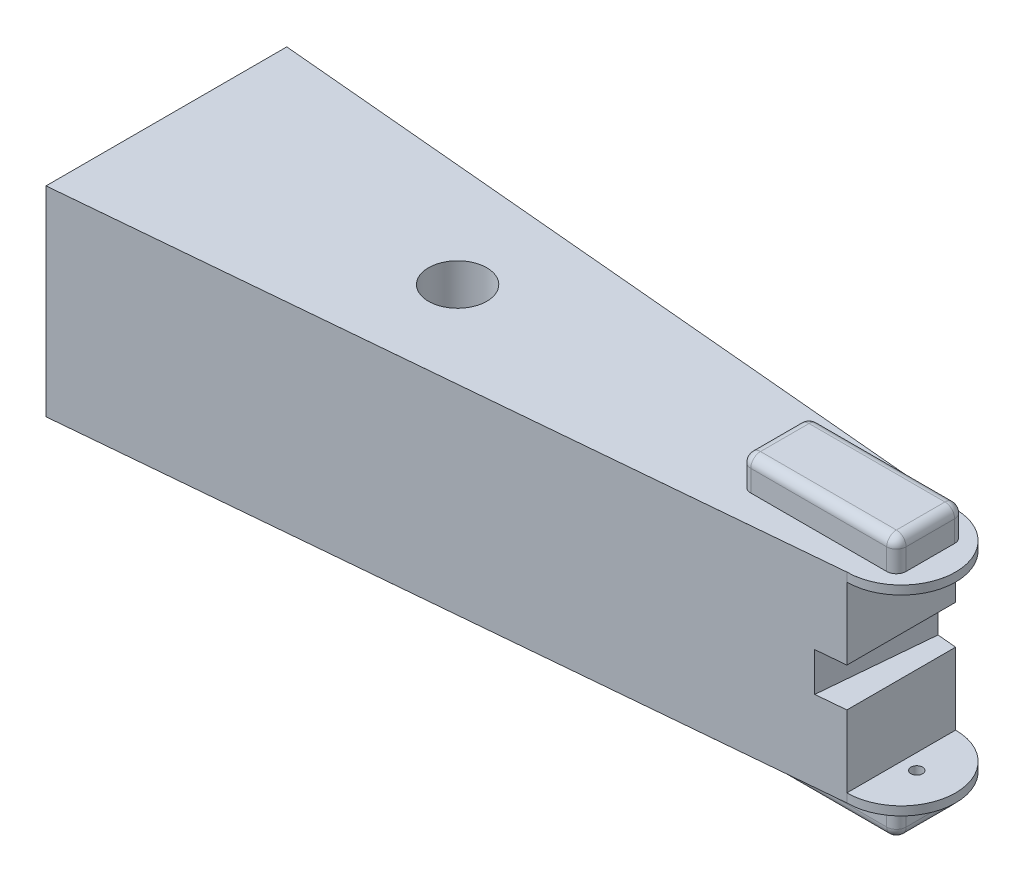
from build123d import *

# Parameters (mm, degrees)
BOSS_EXTRUDE1_DEPTH  = 103
FILLET1_R            = 0.001
SKETCH3_W            = 80
SKETCH3_H            = 35
BOSS_EXTRUDE2_DEPTH  = 16
FILLET2_R            = 5
SKETCH4_R            = 15
CUT_EXTRUDE1_DEPTH   = 424.88163248
CUT_EXTRUDE10_DEPTH  = 47
SKETCH17_W           = 20
SKETCH17_H           = 20
CUT_EXTRUDE13_DEPTH  = 94
FILLET2_OF_MIRROR1_R = 5
SKETCH19_R           = 3
CUT_EXTRUDE14_DEPTH  = 10
CUT_EXTRUDE15_START  = -10
SKETCH20_R           = 3
CUT_EXTRUDE15_DEPTH  = 10


with BuildPart() as part:
    # Sketch1 → Boss-Extrude1 (new body)
    with BuildSketch(Plane(origin=(0, 0, 0), x_dir=(1, 0, 0), z_dir=(0, 1, 0))):
        with BuildLine():
            Line((0, -62), (0, 62))
            Line((0, 62), (378.47589091, 28))
            ThreePointArc((378.47589091, 28), (406.47589091, 0), (378.47589091, -28))
            Line((378.47589091, -28), (0, -62))
        make_face()
    extrude(amount=BOSS_EXTRUDE1_DEPTH)

    # Fillet1
    fillet1_edges = [part.edges().sort_by_distance(p)[0] for p in [
        (378.47589091, 51.5, 28),
        (406.47589091, 103, 0),
        (378.47589091, 51.5, -28),
        (406.47589091, 0, 0),
        (0, 51.5, -62),
        (0, 103, 0),
        (0, 51.5, 62),
        (0, 0, 0),
        (189.237945455, 0, 45),
        (189.237945455, 0, -45),
        (189.237945455, 103, 45),
        (189.237945455, 103, -45),
    ]]
    fillet(fillet1_edges, radius=FILLET1_R)

    # Sketch3 → Boss-Extrude2 (add)
    with BuildSketch(Plane(origin=(0, 0, 0), x_dir=(-1, 0, 0), z_dir=(0, -1, 0))):
        with Locations((-353.47589091, 0)):
            Rectangle(SKETCH3_W, SKETCH3_H)
    boss_extrude2 = extrude(amount=BOSS_EXTRUDE2_DEPTH)

    # Fillet2
    fillet2_edges = [part.edges().sort_by_distance(p)[0] for p in [
        (313.47589091, -8, 17.5),
        (313.47589091, -8, -17.5),
        (393.47589091, -8, -17.5),
        (393.47589091, -8, 17.5),
        (313.47589091, -16, 0),
        (353.47589091, -16, -17.5),
        (393.47589091, -16, 0),
        (353.47589091, -16, 17.5),
    ]]
    fillet(fillet2_edges, radius=FILLET2_R)

    # Sketch4 → Cut-Extrude1 (cut, through all)
    with BuildSketch(Plane.XZ):
        with Locations(Location((150.001, 0, 0), (0, 0, 270))):
            Circle(SKETCH4_R)
    extrude(amount=-CUT_EXTRUDE1_DEPTH, mode=Mode.SUBTRACT)

    # Sketch15 → Cut-Extrude10 (cut, symmetric)
    with BuildSketch(Plane(origin=(0, 51.5, 0), x_dir=(-1, 0, 0), z_dir=(0, -1, 0))):
        with BuildLine():
            Line((-378.47589091, 29), (-378.47589091, -29))
            ThreePointArc((-378.47589091, -29), (-407.47589091, 0), (-378.47589091, 29))
        make_face()
    extrude(amount=CUT_EXTRUDE10_DEPTH, both=True, mode=Mode.SUBTRACT)

    # Sketch17 → Cut-Extrude13 (cut)
    with BuildSketch(Plane(origin=(5.525118961, 0, -61.50365651), x_dir=(-0.9959891866048521, 0, -0.08947368421052682), z_dir=(0.08947368421052682, 0, -0.9959891866048521))):
        with Locations((-374.452586753, 51.5)):
            Rectangle(SKETCH17_W, SKETCH17_H)
    extrude(amount=-CUT_EXTRUDE13_DEPTH, mode=Mode.SUBTRACT)

    # Mirror1: Boss-Extrude2 across plane
    add(boss_extrude2.mirror(Plane(origin=(0, 51.5, 0), x_dir=(0, 0, 1), z_dir=(0, -1, 0))))

    # Fillet2 of Mirror1
    fillet2_of_mirror1_edges = [part.edges().sort_by_distance(p)[0] for p in [
        (313.47589091, 111, 17.5),
        (313.47589091, 111, -17.5),
        (393.47589091, 111, -17.5),
        (393.47589091, 111, 17.5),
        (313.47589091, 119, 0),
        (353.47589091, 119, -17.5),
        (393.47589091, 119, 0),
        (353.47589091, 119, 17.5),
    ]]
    fillet(fillet2_of_mirror1_edges, radius=FILLET2_OF_MIRROR1_R)

    # Sketch19 → Cut-Extrude14 (cut)
    with BuildSketch(Plane(origin=(0, 4.5, 0), x_dir=(1, 0, 0), z_dir=(0, 1, 0))):
        with Locations(Location((386.47589091, 0, 0), (0, 0, 270))):
            Circle(SKETCH19_R)
    extrude(amount=-CUT_EXTRUDE14_DEPTH, mode=Mode.SUBTRACT)

    # Sketch20 → Cut-Extrude15 (cut)
    with BuildSketch(Plane.XZ.offset(-98.5).offset(CUT_EXTRUDE15_START)):
        with Locations(Location((386.47589091, 0, 0), (0, 0, 90))):
            Circle(SKETCH20_R)
    extrude(amount=CUT_EXTRUDE15_DEPTH, mode=Mode.SUBTRACT)


solid = part.part
